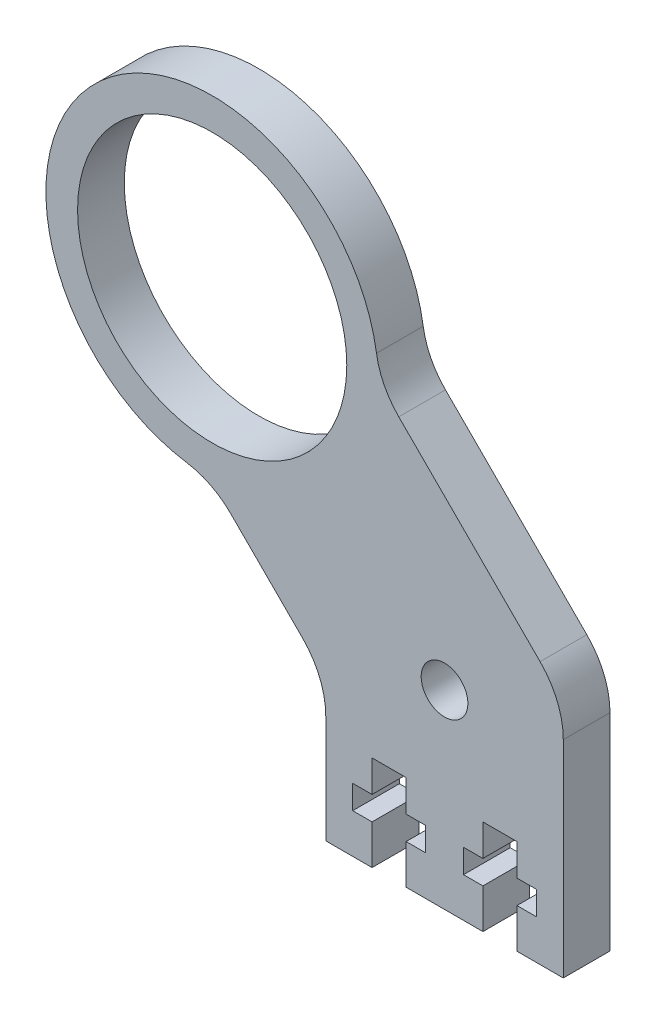
from build123d import *

# Parameters (mm, degrees)
SKETCH1_R           = 2.95
BOSS_EXTRUDE1_DEPTH = 5.9
SKETCH2_R           = 17
CUT_EXTRUDE1_DEPTH  = 72.442524026
CUT_EXTRUDE2_DEPTH  = 72.442524026
FILLET1_R           = 10


with BuildPart() as part:
    # Sketch1 → Boss-Extrude1 (new body)
    with BuildSketch(Plane.XY):
        with BuildLine():
            Line((-15, -6.213203436), (-15, -24))
            Line((-15, -24), (15, -24))
            Line((15, -24), (15, 6.213203436))
            Line((15, 6.213203436), (-8.346024856, 29.559228292))
            ThreePointArc((-8.346024856, 29.559228292), (-44.194173824, 44.194173824), (-29.559228292, 8.346024856))
            Line((-29.559228292, 8.346024856), (-15, -6.213203436))
        make_face()
        Circle(SKETCH1_R, mode=Mode.SUBTRACT)
    extrude(amount=BOSS_EXTRUDE1_DEPTH)

    # Sketch2 → Cut-Extrude1 (cut, through all)
    with BuildSketch(Plane.XY.offset(5.9)):
        with Locations((-29.344931419, 29.344931419)):
            Circle(SKETCH2_R)
    extrude(amount=-CUT_EXTRUDE1_DEPTH, mode=Mode.SUBTRACT)

    # Sketch3 → Cut-Extrude2 (cut, through all)
    with BuildSketch(Plane.XY.offset(5.9)):
        Polygon((-9.15, -24), (-4.85, -24), (-4.85, -19), (-2.4, -19), (-2.4, -16), (-4.85, -16), (-4.85, -12), (-9.15, -12), (-9.15, -16), (-11.6, -16), (-11.6, -19), (-9.15, -19), align=None)
        Polygon((4.85, -16), (4.85, -12), (9.15, -12), (9.15, -16), (11.6, -16), (11.6, -19), (9.15, -19), (9.15, -24), (4.85, -24), (4.85, -19), (2.4, -19), (2.4, -16), align=None)
    extrude(amount=-CUT_EXTRUDE2_DEPTH, mode=Mode.SUBTRACT)

    # Fillet1
    fillet1_edges = [part.edges().sort_by_distance(p)[0] for p in [
        (-8.346024856, 29.559228292, 2.95),
        (15, 6.213203436, 2.95),
        (-15, -6.213203436, 2.95),
        (-29.559228292, 8.346024856, 2.95),
    ]]
    fillet(fillet1_edges, radius=FILLET1_R)


solid = part.part
